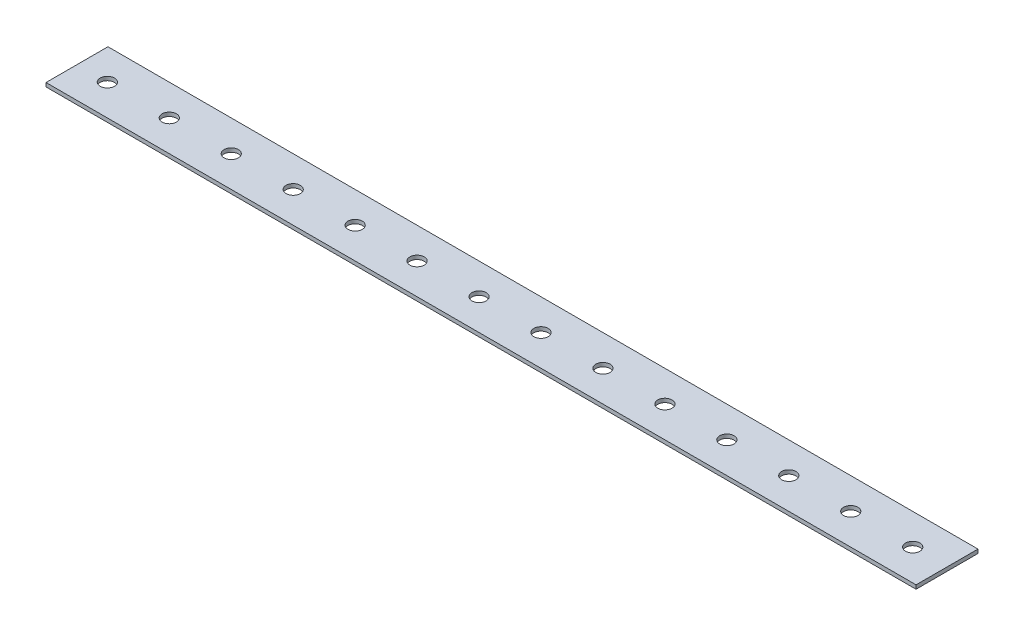
from build123d import *

# Parameters (mm, degrees)
SKETCH1_W           = 701.876631599
SKETCH1_H           = 49.976737776
SKETCH1_R           = 5.778560305
BOSS_EXTRUDE1_DEPTH = 3.1


with BuildPart() as part:
    # Sketch1 → Boss-Extrude1 (new body)
    with BuildSketch(Plane(origin=(0, 0, 0), x_dir=(1, 0, 0), z_dir=(0, 1, 0))):
        with Locations((709.588876406, -495.502605974)):
            Rectangle(SKETCH1_W, SKETCH1_H)
        with Locations(Location((383.143601119, -495.502605974, 0), (0, 0, 90))):
            Circle(SKETCH1_R, mode=Mode.SUBTRACT)
        with Locations(Location((433.120338895, -495.502605974, 0), (0, 0, 90))):
            Circle(SKETCH1_R, mode=Mode.SUBTRACT)
        with Locations(Location((483.097076671, -495.502605974, 0), (0, 0, 90))):
            Circle(SKETCH1_R, mode=Mode.SUBTRACT)
        with Locations(Location((533.073814447, -495.502605974, 0), (0, 0, 90))):
            Circle(SKETCH1_R, mode=Mode.SUBTRACT)
        with Locations(Location((583.050552222, -495.502605974, 0), (0, 0, 90))):
            Circle(SKETCH1_R, mode=Mode.SUBTRACT)
        with Locations(Location((633.027289998, -495.502605974, 0), (0, 0, 90))):
            Circle(SKETCH1_R, mode=Mode.SUBTRACT)
        with Locations(Location((683.004027774, -495.502605974, 0), (0, 0, 90))):
            Circle(SKETCH1_R, mode=Mode.SUBTRACT)
        with Locations(Location((732.98076555, -495.502605974, 0), (0, 0, 90))):
            Circle(SKETCH1_R, mode=Mode.SUBTRACT)
        with Locations(Location((782.957503326, -495.502605974, 0), (0, 0, 90))):
            Circle(SKETCH1_R, mode=Mode.SUBTRACT)
        with Locations(Location((832.934241102, -495.502605974, 0), (0, 0, 90))):
            Circle(SKETCH1_R, mode=Mode.SUBTRACT)
        with Locations(Location((882.910978877, -495.502605974, 0), (0, 0, 90))):
            Circle(SKETCH1_R, mode=Mode.SUBTRACT)
        with Locations(Location((932.887716653, -495.502605974, 0), (0, 0, 90))):
            Circle(SKETCH1_R, mode=Mode.SUBTRACT)
        with Locations(Location((982.864454429, -495.502605974, 0), (0, 0, 90))):
            Circle(SKETCH1_R, mode=Mode.SUBTRACT)
        with Locations(Location((1032.841192205, -495.502605974, 0), (0, 0, 90))):
            Circle(SKETCH1_R, mode=Mode.SUBTRACT)
    extrude(amount=BOSS_EXTRUDE1_DEPTH)


solid = part.part
